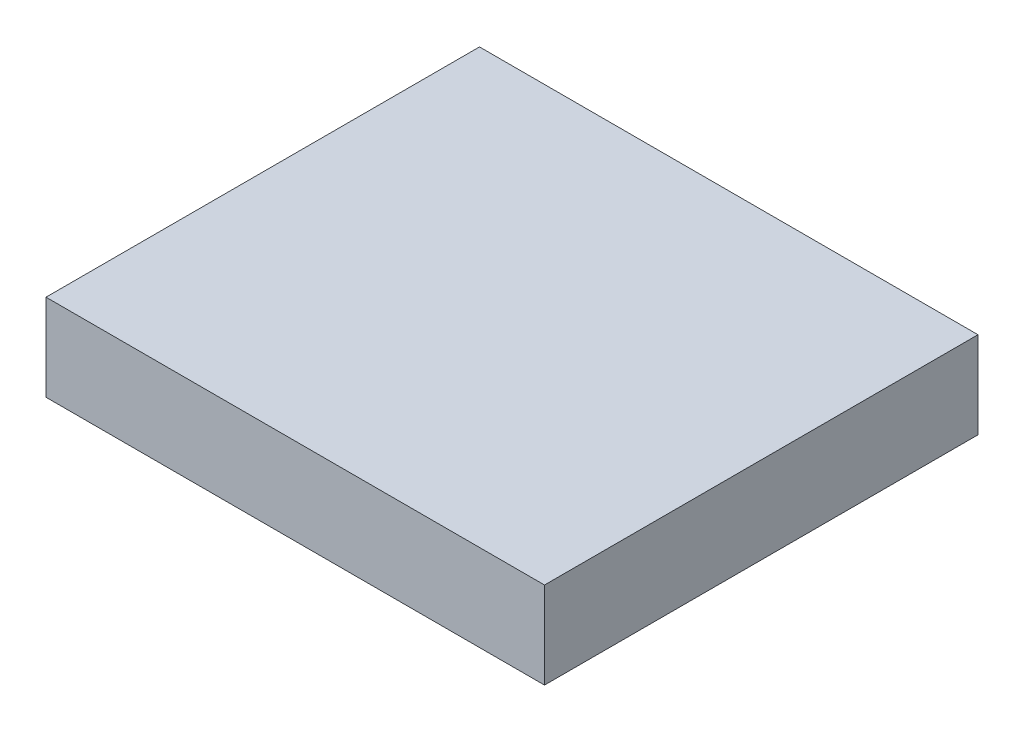
from build123d import *

# Parameters (mm, degrees)
SKETCH2_W           = 11.5
SKETCH2_H           = 10
BOSS_EXTRUDE1_DEPTH = 2
SCALE1_SCALE        = 10


with BuildPart() as part:
    # Sketch2 → Boss-Extrude1 (new body)
    with BuildSketch(Plane(origin=(0, 0, 0), x_dir=(1, 0, 0), z_dir=(0, 1, 0))):
        with Locations((0.226760563, -1.55)):
            Rectangle(SKETCH2_W, SKETCH2_H)
    extrude(amount=BOSS_EXTRUDE1_DEPTH)


with BuildPart() as part_1:
    # Scale1: scaled about (0.226760563, 1, 1.55)
    add(part.part.scale(SCALE1_SCALE).moved(Location((-2.040845067, -9, -13.95))))


solid = part_1.part
